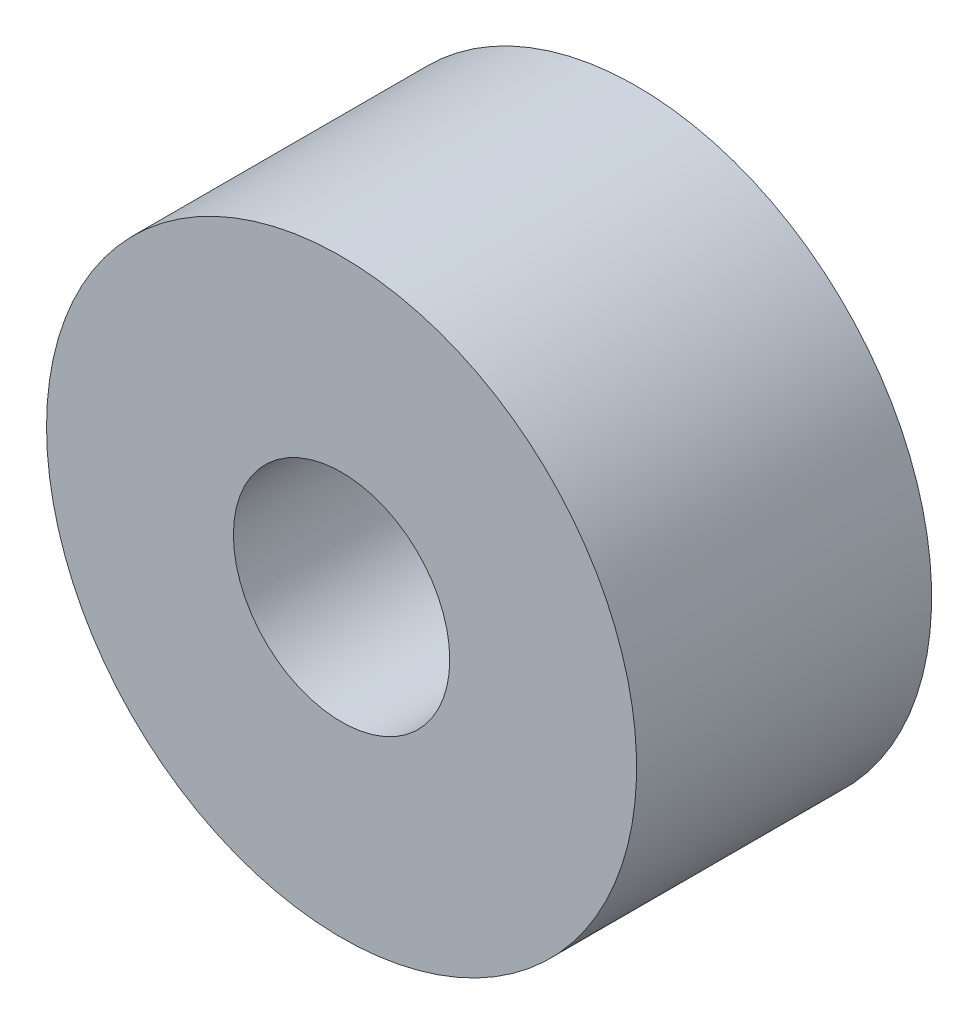
from build123d import *

# Parameters (mm, degrees)
SKETCH2_R           = 9.525
BOSS_EXTRUDE1_DEPTH = 9.525
SKETCH4_R           = 4.7625
BOSS_EXTRUDE2_DEPTH = 3.175
SKETCH8_R           = 3.4925
CUT_EXTRUDE1_DEPTH  = 30.084172731


with BuildPart() as part:
    # Sketch2 → Boss-Extrude1 (new body)
    with BuildSketch(Plane.XY):
        with Locations(Location((-14.404556939, 1.056843325, 0), (0, 0, 180))):
            Circle(SKETCH2_R)
    extrude(amount=BOSS_EXTRUDE1_DEPTH)

    # Sketch4 → Boss-Extrude2 (add)
    with BuildSketch(Plane(origin=(0, 0, 0), x_dir=(-1, 0, 0), z_dir=(0, 0, -1))):
        with Locations((14.404556939, 1.056843325)):
            Circle(SKETCH4_R)
    extrude(amount=BOSS_EXTRUDE2_DEPTH)

    # Sketch8 → Cut-Extrude1 (cut, through all)
    with BuildSketch(Plane(origin=(0, 0, -3.175), x_dir=(-1, 0, 0), z_dir=(0, 0, -1))):
        with Locations((14.404556939, 1.056843325)):
            Circle(SKETCH8_R)
    extrude(amount=-CUT_EXTRUDE1_DEPTH, mode=Mode.SUBTRACT)


solid = part.part
